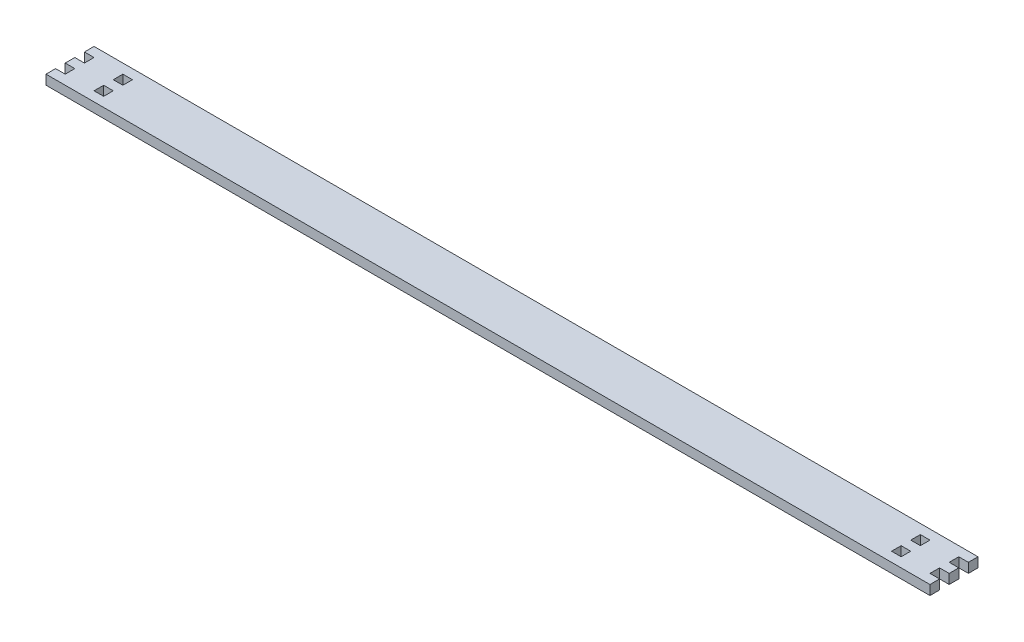
from build123d import *

# Parameters (mm, degrees)
SKETCH_1_W      = 10
SKETCH_1_H      = 10
EXTRUDE_1_DEPTH = 10


with BuildPart() as part:
    # Эскиз1 → Бобышка-Вытянуть1 (new body)
    with BuildSketch(Plane(origin=(0, 0, 0), x_dir=(1, 0, 0), z_dir=(0, 1, 0))):
        Polygon((-450, 5), (-450, 15), (-460, 15), (-460, 25), (-450, 25), (450, 25), (460, 25), (460, 15), (450, 15), (450, 5), (460, 5), (460, -5), (450, -5), (450, -15), (460, -15), (460, -25), (450, -25), (-450, -25), (-460, -25), (-460, -15), (-450, -15), (-450, -5), (-460, -5), (-460, 5), align=None)
        with Locations((-415, -10)):
            Rectangle(SKETCH_1_W, SKETCH_1_H, mode=Mode.SUBTRACT)
        with Locations((-415, 10)):
            Rectangle(SKETCH_1_W, SKETCH_1_H, mode=Mode.SUBTRACT)
        with Locations((415, 10)):
            Rectangle(SKETCH_1_W, SKETCH_1_H, mode=Mode.SUBTRACT)
        with Locations((415, -10)):
            Rectangle(SKETCH_1_W, SKETCH_1_H, mode=Mode.SUBTRACT)
    extrude(amount=EXTRUDE_1_DEPTH)


solid = part.part
